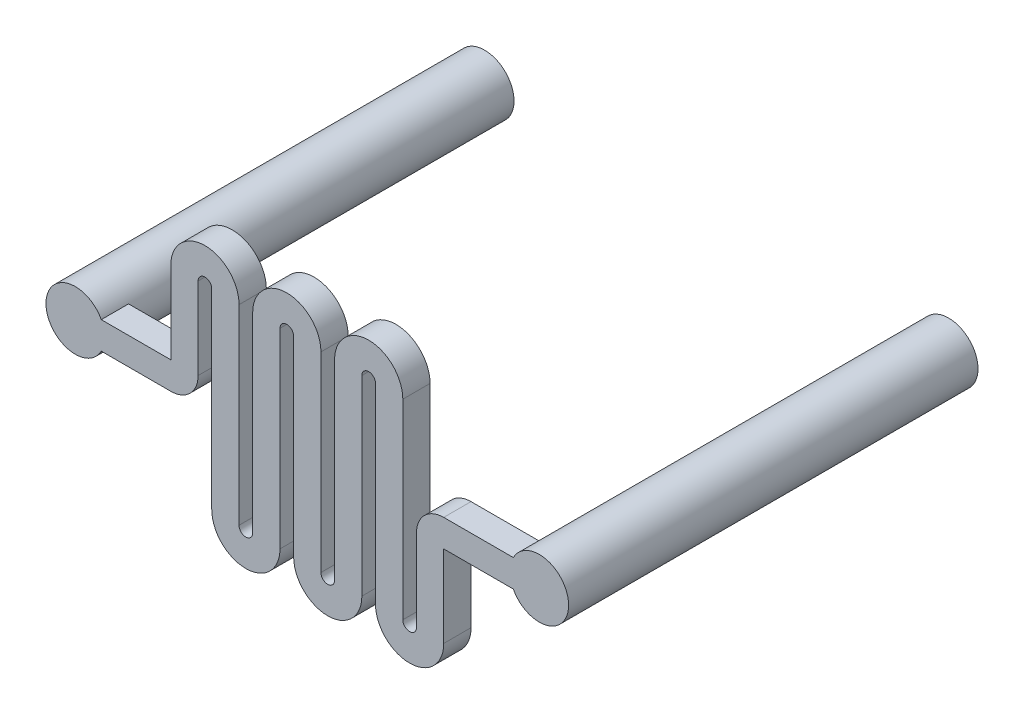
from build123d import *

# Parameters (mm, degrees)
BOSS_EXTRUDE1_DEPTH = 2
SKETCH3_W           = 2.15
SKETCH3_H           = 30
SKETCH4_W           = 2.15
SKETCH4_H           = 30
SKETCH6_R           = 1.5
CUT_EXTRUDE1_DEPTH  = 29


with BuildPart() as part:
    # Sketch2 → Boss-Extrude1 (new body)
    with BuildSketch(Plane.XY):
        with BuildLine():
            Line((-20.5, -1), (-13.5, -1))
            ThreePointArc((-13.5, -1), (-12.085786438, -0.414213562), (-11.5, 1))
            Line((-11.5, 1), (-11.5, 7))
            ThreePointArc((-11.5, 7), (-11, 7.5), (-10.5, 7))
            Line((-10.5, 7), (-10.5, 0))
            Line((-10.5, 0), (-10.5, -7))
            ThreePointArc((-10.5, -7), (-8, -9.5), (-5.5, -7))
            Line((-5.5, -7), (-5.5, 0))
            Line((-5.5, 0), (-5.5, 7))
            ThreePointArc((-5.5, 7), (-5, 7.5), (-4.5, 7))
            Line((-4.5, 7), (-4.5, 0))
            Line((-4.5, 0), (-4.5, -7))
            ThreePointArc((-4.5, -7), (-2, -9.5), (0.5, -7))
            Line((0.5, -7), (0.5, 0))
            Line((0.5, 0), (0.5, 7))
            ThreePointArc((0.5, 7), (1, 7.5), (1.5, 7))
            Line((1.5, 7), (1.5, 0))
            Line((1.5, 0), (1.5, -7))
            ThreePointArc((1.5, -7), (4, -9.5), (6.5, -7))
            Line((6.5, -7), (6.5, -1))
            Line((6.5, -1), (13.5, -1))
            ThreePointArc((13.5, -1), (14.5, 0), (13.5, 1))
            Line((13.5, 1), (6.5, 1))
            ThreePointArc((6.5, 1), (5.085786438, 0.414213562), (4.5, -1))
            Line((4.5, -1), (4.5, -7))
            ThreePointArc((4.5, -7), (4, -7.5), (3.5, -7))
            Line((3.5, -7), (3.5, 0))
            Line((3.5, 0), (3.5, 7))
            ThreePointArc((3.5, 7), (1, 9.5), (-1.5, 7))
            Line((-1.5, 7), (-1.5, 0))
            Line((-1.5, 0), (-1.5, -7))
            ThreePointArc((-1.5, -7), (-2, -7.5), (-2.5, -7))
            Line((-2.5, -7), (-2.5, 0))
            Line((-2.5, 0), (-2.5, 7))
            ThreePointArc((-2.5, 7), (-5, 9.5), (-7.5, 7))
            Line((-7.5, 7), (-7.5, 0))
            Line((-7.5, 0), (-7.5, -7))
            ThreePointArc((-7.5, -7), (-8, -7.5), (-8.5, -7))
            Line((-8.5, -7), (-8.5, 0))
            Line((-8.5, 0), (-8.5, 7))
            ThreePointArc((-8.5, 7), (-11, 9.5), (-13.5, 7))
            Line((-13.5, 7), (-13.5, 1))
            Line((-13.5, 1), (-20.5, 1))
            ThreePointArc((-20.5, 1), (-21.5, 0), (-20.5, -1))
        make_face()
    extrude(amount=BOSS_EXTRUDE1_DEPTH)

    # Sketch3 → Revolve1 (revolve)
    with BuildSketch(Plane(origin=(0, 0, 0), x_dir=(1, 0, 0), z_dir=(0, 1, 0)), mode=Mode.PRIVATE) as revolve1_sk:
        with Locations((-21.575, 13)):
            Rectangle(SKETCH3_W, SKETCH3_H)
    revolve(revolve1_sk.sketch.rotate(Axis((-20.5, 0, 2), (0, 0, -1)), 180), axis=Axis((-20.5, 0, 2), (0, 0, -1)))

    # Sketch4 → Revolve2 (revolve)
    with BuildSketch(Plane(origin=(0, 0, 0), x_dir=(1, 0, 0), z_dir=(0, 1, 0))):
        with Locations((14.575, 13)):
            Rectangle(SKETCH4_W, SKETCH4_H)
    revolve(axis=Axis((13.5, 0, 2), (0, 0, -1)))

    # Sketch6 → Cut-Extrude1 (cut)
    with BuildSketch(Plane(origin=(0, 0, -28), x_dir=(-1, 0, 0), z_dir=(0, 0, -1))):
        with Locations((-13.5, 0)):
            Circle(SKETCH6_R)
        with Locations((20.5, 0)):
            Circle(SKETCH6_R)
    extrude(amount=-CUT_EXTRUDE1_DEPTH, mode=Mode.SUBTRACT)


solid = part.part
